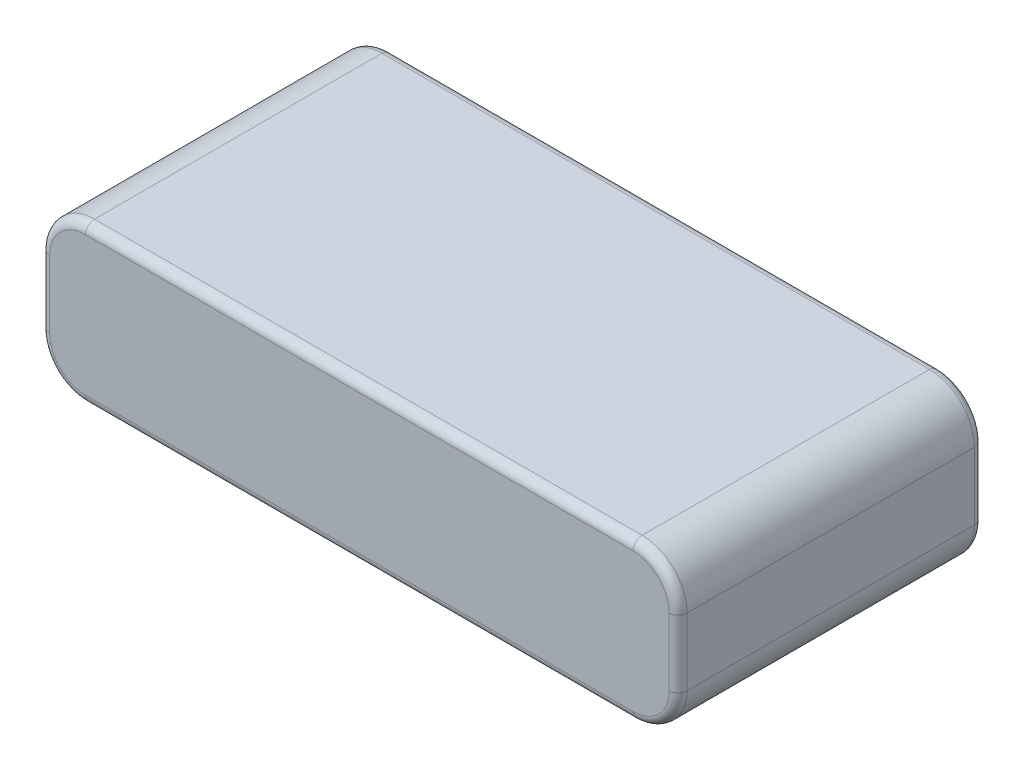
from build123d import *

# Parameters (mm, degrees)
SKETCH1_W           = 71
SKETCH1_H           = 34
BOSS_EXTRUDE1_DEPTH = 17.5
FILLET1_R           = 5
FILLET2_R           = 1


with BuildPart() as part:
    # Sketch1 → Boss-Extrude1 (new body)
    with BuildSketch(Plane(origin=(0, 0, 0), x_dir=(1, 0, 0), z_dir=(0, 1, 0))):
        Rectangle(SKETCH1_W, SKETCH1_H)
    extrude(amount=BOSS_EXTRUDE1_DEPTH)

    # Fillet1
    fillet1_edges = [part.edges().sort_by_distance(p)[0] for p in [
        (35.5, 17.5, 0),
        (-35.5, 17.5, 0),
        (35.5, 0, 0),
        (-35.5, 0, 0),
    ]]
    fillet(fillet1_edges, radius=FILLET1_R)

    # Fillet2
    fillet2_edges = [part.edges().sort_by_distance(p)[0] for p in [
        (-35.5, 8.75, 17),
        (-35.5, 8.75, -17),
        (0, 0, 17),
        (35.5, 8.75, 17),
        (0, 17.5, 17),
        (-34.035533906, 16.035533906, 17),
        (34.035533906, 16.035533906, 17),
        (34.035533906, 1.464466094, 17),
        (-34.035533906, 1.464466094, 17),
        (0, 0, -17),
        (0, 17.5, -17),
        (35.5, 8.75, -17),
        (-34.035533906, 16.035533906, -17),
        (34.035533906, 16.035533906, -17),
        (34.035533906, 1.464466094, -17),
        (-34.035533906, 1.464466094, -17),
    ]]
    fillet(fillet2_edges, radius=FILLET2_R)


solid = part.part
